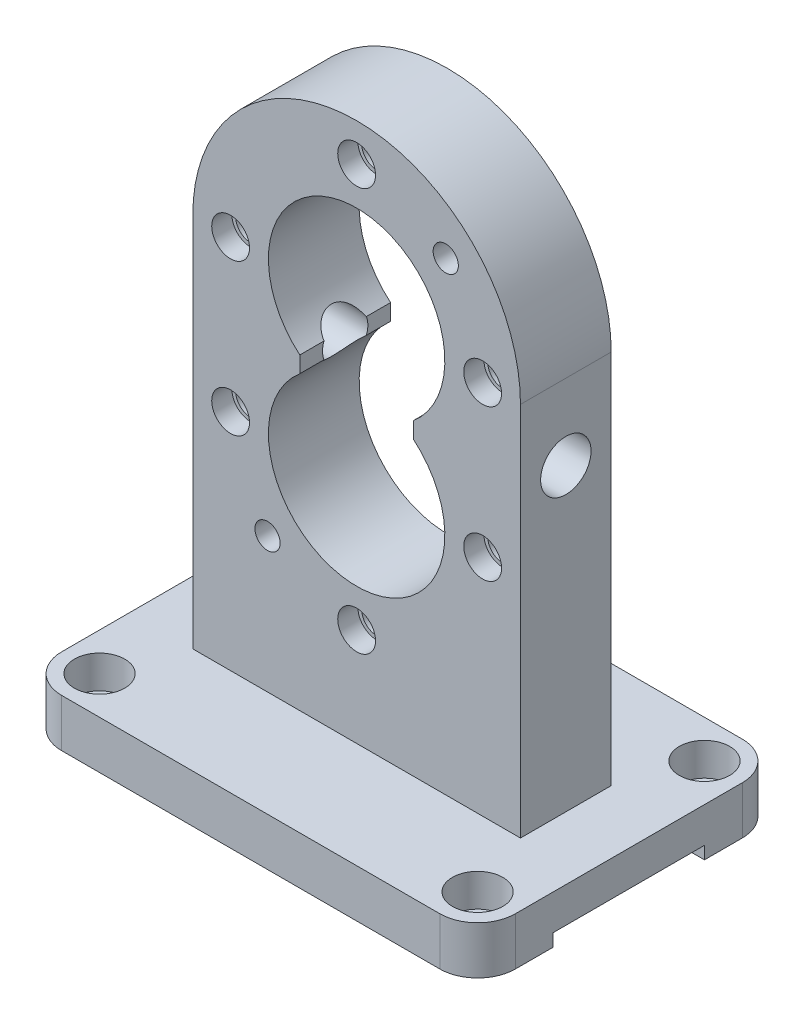
from build123d import *

# Parameters (mm, degrees)
SKETCH1_R           = 7.5
BOSS_EXTRUDE1_DEPTH = 19
SKETCH1_3_R         = 10
SKETCH1_3_R_2       = 7.5
CUT_EXTRUDE1_DEPTH  = 13
SKETCH2_R           = 6
SKETCH2_R_2         = 5
BOSS_EXTRUDE3_DEPTH = 18
SKETCH11_R          = 10
SKETCH11_R_2        = 7.5
BOSS_EXTRUDE4_DEPTH = 13
SKETCH12_R          = 10
CUT_EXTRUDE7_DEPTH  = 13
SKETCH3_W           = 60
SKETCH3_H           = 5
CUT_EXTRUDE2_DEPTH  = 180
SKETCH4_R           = 7.5
CUT_EXTRUDE3_DEPTH  = 8
SKETCH5_R           = 9
CUT_EXTRUDE4_DEPTH  = 130
SKETCH6_R           = 11
CUT_EXTRUDE5_DEPTH  = 15
SKETCH7_R           = 10
CUT_EXTRUDE6_DEPTH  = 15


with BuildPart() as part:
    # Sketch1 → Boss-Extrude1 (new body)
    with BuildSketch(Plane(origin=(0, 0, 0), x_dir=(1, 0, 0), z_dir=(0, 1, 0))):
        with BuildLine():
            ThreePointArc((0, 15), (4.393398282, 4.393398282), (15, 0))
            Line((15, 0), (165, 0))
            ThreePointArc((165, 0), (175.606601718, 4.393398282), (180, 15))
            Line((180, 15), (180, 105))
            ThreePointArc((180, 105), (175.606601718, 115.606601718), (165, 120))
            Line((165, 120), (15, 120))
            ThreePointArc((15, 120), (4.393398282, 115.606601718), (0, 105))
            Line((0, 105), (0, 15))
        make_face()
        with Locations((15, 15)):
            Circle(SKETCH1_R, mode=Mode.SUBTRACT)
        with Locations((165, 15)):
            Circle(SKETCH1_R, mode=Mode.SUBTRACT)
        with Locations((15, 105)):
            Circle(SKETCH1_R, mode=Mode.SUBTRACT)
        with Locations((165, 105)):
            Circle(SKETCH1_R, mode=Mode.SUBTRACT)
    extrude(amount=BOSS_EXTRUDE1_DEPTH)

    # Sketch1<3> → Cut-Extrude1 (cut)
    # profile 1 of 4: a face of its own
    with BuildSketch(Plane(origin=(0, 0, 0), x_dir=(1, 0, 0), z_dir=(0, 1, 0))):
        with Locations((15, 105)):
            Circle(SKETCH1_3_R)
        with Locations((15, 105)):
            Circle(SKETCH1_3_R_2, mode=Mode.SUBTRACT)
    # profile 2 of 4: a face of its own
    with BuildSketch(Plane(origin=(0, 0, 0), x_dir=(1, 0, 0), z_dir=(0, 1, 0))):
        with Locations((165, 105)):
            Circle(SKETCH1_3_R)
        with Locations((165, 105)):
            Circle(SKETCH1_3_R_2, mode=Mode.SUBTRACT)
    # profile 3 of 4: a face of its own
    with BuildSketch(Plane(origin=(0, 0, 0), x_dir=(1, 0, 0), z_dir=(0, 1, 0))):
        with Locations((165, 15)):
            Circle(SKETCH1_3_R)
        with Locations((165, 15)):
            Circle(SKETCH1_3_R_2, mode=Mode.SUBTRACT)
    # profile 4 of 4: a face of its own
    with BuildSketch(Plane(origin=(0, 0, 0), x_dir=(1, 0, 0), z_dir=(0, 1, 0))):
        with Locations((15, 15)):
            Circle(SKETCH1_3_R)
        with Locations((15, 15)):
            Circle(SKETCH1_3_R_2, mode=Mode.SUBTRACT)
    extrude(amount=CUT_EXTRUDE1_DEPTH, mode=Mode.SUBTRACT)

    # Sketch2 → Boss-Extrude3 (add, symmetric)
    with BuildSketch(Plane.XY.offset(-60)):
        with BuildLine():
            Line((25, 0), (155, 0))
            Line((155, 0), (155, 168))
            ThreePointArc((155, 168), (90, 233), (25, 168))
            Line((25, 168), (25, 0))
        make_face()
        with Locations((90, 218)):
            Circle(SKETCH2_R, mode=Mode.SUBTRACT)
        with Locations((140, 168)):
            Circle(SKETCH2_R, mode=Mode.SUBTRACT)
        with Locations((90, 58)):
            Circle(SKETCH2_R, mode=Mode.SUBTRACT)
        with Locations((40, 168)):
            Circle(SKETCH2_R, mode=Mode.SUBTRACT)
        with Locations((40, 108)):
            Circle(SKETCH2_R, mode=Mode.SUBTRACT)
        with Locations((140, 108)):
            Circle(SKETCH2_R, mode=Mode.SUBTRACT)
        with Locations((54.644660941, 72.644660941)):
            Circle(SKETCH2_R_2, mode=Mode.SUBTRACT)
        with Locations((125.355339059, 203.355339059)):
            Circle(SKETCH2_R_2, mode=Mode.SUBTRACT)
        with BuildLine():
            Line((67.460330813, 141.223829382), (67.460330813, 134.776170618))
            ThreePointArc((67.460330813, 134.776170618), (90, 73), (112.539669187, 134.776170618))
            Line((112.539669187, 134.776170618), (112.539669187, 141.223829382))
            ThreePointArc((112.539669187, 141.223829382), (90, 203), (67.460330813, 141.223829382))
        make_face(mode=Mode.SUBTRACT)
    extrude(amount=BOSS_EXTRUDE3_DEPTH, both=True)

    # Sketch11 → Boss-Extrude4 (add)
    # profile 1 of 4: a face of its own
    with BuildSketch(Plane.XZ):
        with Locations((15, -15)):
            Circle(SKETCH11_R)
        with Locations((15, -15)):
            Circle(SKETCH11_R_2, mode=Mode.SUBTRACT)
    # profile 2 of 4: a face of its own
    with BuildSketch(Plane.XZ):
        with Locations((165, -15)):
            Circle(SKETCH11_R)
        with Locations((165, -15)):
            Circle(SKETCH11_R_2, mode=Mode.SUBTRACT)
    # profile 3 of 4: a face of its own
    with BuildSketch(Plane.XZ):
        with Locations((165, -105)):
            Circle(SKETCH11_R)
        with Locations((165, -105)):
            Circle(SKETCH11_R_2, mode=Mode.SUBTRACT)
    # profile 4 of 4: a face of its own
    with BuildSketch(Plane.XZ):
        with Locations((15, -105)):
            Circle(SKETCH11_R)
        with Locations((15, -105)):
            Circle(SKETCH11_R_2, mode=Mode.SUBTRACT)
    extrude(amount=-BOSS_EXTRUDE4_DEPTH)

    # Sketch12 → Cut-Extrude7 (cut)
    with BuildSketch(Plane(origin=(0, 19, 0), x_dir=(1, 0, 0), z_dir=(0, 1, 0))):
        with Locations((15, 105)):
            Circle(SKETCH12_R)
        with Locations((165, 105)):
            Circle(SKETCH12_R)
        with Locations((165, 15)):
            Circle(SKETCH12_R)
        with Locations((15, 15)):
            Circle(SKETCH12_R)
    extrude(amount=-CUT_EXTRUDE7_DEPTH, mode=Mode.SUBTRACT)

    # Sketch3 → Cut-Extrude2 (cut)
    with BuildSketch(Plane(origin=(180, 0, 0), x_dir=(0, 0, -1), z_dir=(1, 0, 0))):
        with Locations((60, 2.5)):
            Rectangle(SKETCH3_W, SKETCH3_H)
    extrude(amount=-CUT_EXTRUDE2_DEPTH, mode=Mode.SUBTRACT)

    # Sketch4 → Cut-Extrude3 (cut)
    with BuildSketch(Plane(origin=(0, 0, -78), x_dir=(-1, 0, 0), z_dir=(0, 0, -1))):
        with Locations((-90, 218)):
            Circle(SKETCH4_R)
        with Locations((-40, 168)):
            Circle(SKETCH4_R)
        with Locations((-40, 108)):
            Circle(SKETCH4_R)
        with Locations((-90, 58)):
            Circle(SKETCH4_R)
        with Locations((-140, 108)):
            Circle(SKETCH4_R)
        with Locations((-140, 168)):
            Circle(SKETCH4_R)
    cut_extrude3 = extrude(amount=-CUT_EXTRUDE3_DEPTH, mode=Mode.SUBTRACT)

    # Mirror1: Cut-Extrude3 across plane
    add(cut_extrude3.mirror(Plane.XY.offset(-60)), mode=Mode.SUBTRACT)

    # Sketch5 → Cut-Extrude4 (cut)
    with BuildSketch(Plane.ZY.offset(-25)):
        with Locations((-60, 138)):
            Circle(SKETCH5_R)
    extrude(amount=-CUT_EXTRUDE4_DEPTH, mode=Mode.SUBTRACT)

    # Sketch6 → Cut-Extrude5 (cut)
    with BuildSketch(Plane.ZY.offset(-25)):
        with Locations((-60, 138)):
            Circle(SKETCH6_R)
    extrude(amount=-CUT_EXTRUDE5_DEPTH, mode=Mode.SUBTRACT)

    # Sketch7 → Cut-Extrude6 (cut)
    with BuildSketch(Plane(origin=(155, 0, 0), x_dir=(0, 0, -1), z_dir=(1, 0, 0))):
        with Locations((60, 138)):
            Circle(SKETCH7_R)
    extrude(amount=-CUT_EXTRUDE6_DEPTH, mode=Mode.SUBTRACT)


solid = part.part
